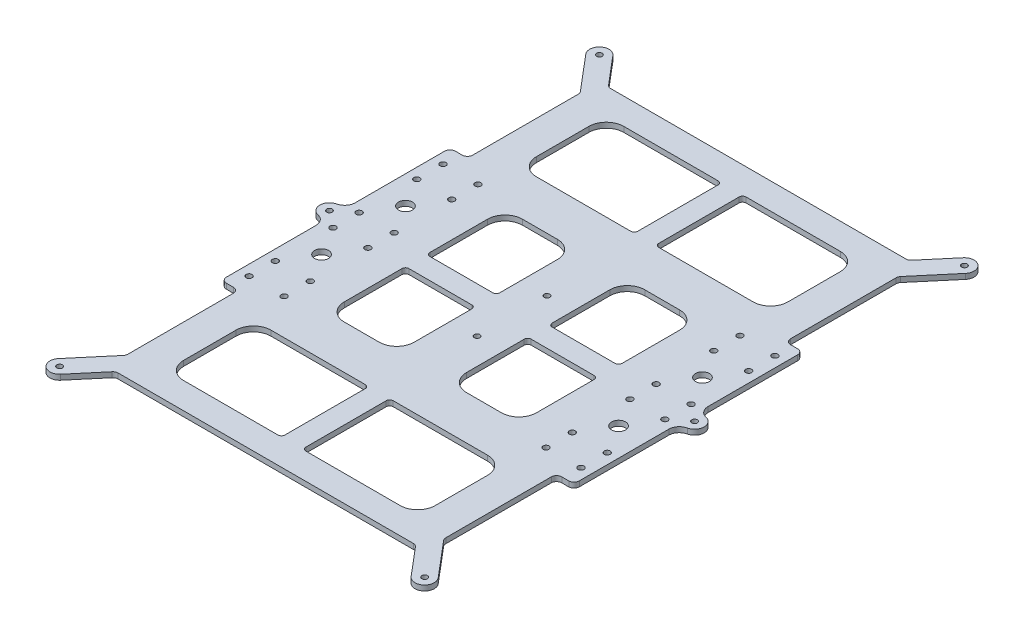
from build123d import *

# Parameters (mm, degrees)
CROQUIS1_W              = 220
CROQUIS1_H              = 320
CROQUIS1_R              = 1.7
CROQUIS1_R_2            = 1.6
CROQUIS1_R_3            = 4
SALIENTE_EXTRUIR1_DEPTH = 3
CROQUIS2_OUTSIDE_W      = 299.668
CROQUIS2_OUTSIDE_H      = 399.668
CORTAR_EXTRUIR1_DEPTH   = 3
REDONDEO1_R             = 3


with BuildPart() as part:
    # Croquis1 → Saliente-Extruir1 (new body)
    with BuildSketch(Plane(origin=(0, 0, 0), x_dir=(1, 0, 0), z_dir=(0, 1, 0))):
        with Locations((110, 160)):
            Rectangle(CROQUIS1_W, CROQUIS1_H)
        with Locations(Location((185, 167.5, 0), (0, 0, 270))):
            Circle(CROQUIS1_R, mode=Mode.SUBTRACT)
        with Locations(Location((205, 167.5, 0), (0, 0, 270))):
            Circle(CROQUIS1_R, mode=Mode.SUBTRACT)
        with Locations(Location((185, 152.5, 0), (0, 0, 90))):
            Circle(CROQUIS1_R, mode=Mode.SUBTRACT)
        with Locations(Location((205, 152.5, 0), (0, 0, 90))):
            Circle(CROQUIS1_R, mode=Mode.SUBTRACT)
        with Locations(Location((35, 215.5, 0), (0, 0, 270))):
            Circle(CROQUIS1_R, mode=Mode.SUBTRACT)
        with Locations(Location((35, 200.5, 0), (0, 0, 270))):
            Circle(CROQUIS1_R, mode=Mode.SUBTRACT)
        with Locations(Location((35, 119.5, 0), (0, 0, 90))):
            Circle(CROQUIS1_R, mode=Mode.SUBTRACT)
        with Locations(Location((35, 104.5, 0), (0, 0, 90))):
            Circle(CROQUIS1_R, mode=Mode.SUBTRACT)
        with Locations(Location((5.5, 314.5, 0), (0, 0, 270))):
            Circle(CROQUIS1_R_2, mode=Mode.SUBTRACT)
        with Locations(Location((214.5, 314.5, 0), (0, 0, 90))):
            Circle(CROQUIS1_R_2, mode=Mode.SUBTRACT)
        with Locations(Location((214.5, 5.5, 0), (0, 0, 270))):
            Circle(CROQUIS1_R_2, mode=Mode.SUBTRACT)
        with Locations(Location((5.5, 5.5, 0), (0, 0, 90))):
            Circle(CROQUIS1_R_2, mode=Mode.SUBTRACT)
        with Locations(Location((15, 200.5, 0), (0, 0, 90))):
            Circle(CROQUIS1_R, mode=Mode.SUBTRACT)
        with Locations(Location((15, 215.5, 0), (0, 0, 90))):
            Circle(CROQUIS1_R, mode=Mode.SUBTRACT)
        with Locations(Location((15, 104.5, 0), (0, 0, 270))):
            Circle(CROQUIS1_R, mode=Mode.SUBTRACT)
        with Locations(Location((15, 119.5, 0), (0, 0, 270))):
            Circle(CROQUIS1_R, mode=Mode.SUBTRACT)
        with Locations(Location((110, 180, 0), (0, 0, 270))):
            Circle(CROQUIS1_R_2, mode=Mode.SUBTRACT)
        with Locations(Location((110, 140, 0), (0, 0, 90))):
            Circle(CROQUIS1_R_2, mode=Mode.SUBTRACT)
        with Locations(Location((185, 104.5, 0), (0, 0, 270))):
            Circle(CROQUIS1_R, mode=Mode.SUBTRACT)
        with Locations(Location((205, 104.5, 0), (0, 0, 90))):
            Circle(CROQUIS1_R, mode=Mode.SUBTRACT)
        with Locations(Location((205, 119.5, 0), (0, 0, 90))):
            Circle(CROQUIS1_R, mode=Mode.SUBTRACT)
        with Locations(Location((185, 119.5, 0), (0, 0, 270))):
            Circle(CROQUIS1_R, mode=Mode.SUBTRACT)
        with Locations(Location((185, 200.5, 0), (0, 0, 90))):
            Circle(CROQUIS1_R, mode=Mode.SUBTRACT)
        with Locations(Location((185, 215.5, 0), (0, 0, 90))):
            Circle(CROQUIS1_R, mode=Mode.SUBTRACT)
        with Locations(Location((205, 200.5, 0), (0, 0, 270))):
            Circle(CROQUIS1_R, mode=Mode.SUBTRACT)
        with Locations(Location((205, 215.5, 0), (0, 0, 270))):
            Circle(CROQUIS1_R, mode=Mode.SUBTRACT)
        with Locations(Location((5.5, 160, 0), (0, 0, 270))):
            Circle(CROQUIS1_R_2, mode=Mode.SUBTRACT)
        with Locations(Location((35, 152.5, 0), (0, 0, 270))):
            Circle(CROQUIS1_R, mode=Mode.SUBTRACT)
        with Locations(Location((15, 152.5, 0), (0, 0, 270))):
            Circle(CROQUIS1_R, mode=Mode.SUBTRACT)
        with Locations(Location((15, 167.5, 0), (0, 0, 90))):
            Circle(CROQUIS1_R, mode=Mode.SUBTRACT)
        with Locations(Location((35, 167.5, 0), (0, 0, 90))):
            Circle(CROQUIS1_R, mode=Mode.SUBTRACT)
        with Locations(Location((214.5, 160, 0), (0, 0, 90))):
            Circle(CROQUIS1_R_2, mode=Mode.SUBTRACT)
        with Locations(Location((25, 136, 0), (0, 0, 270))):
            Circle(CROQUIS1_R_3, mode=Mode.SUBTRACT)
        with Locations(Location((25, 184, 0), (0, 0, 90))):
            Circle(CROQUIS1_R_3, mode=Mode.SUBTRACT)
        with Locations(Location((195, 136, 0), (0, 0, 90))):
            Circle(CROQUIS1_R_3, mode=Mode.SUBTRACT)
        with Locations(Location((195, 184, 0), (0, 0, 270))):
            Circle(CROQUIS1_R_3, mode=Mode.SUBTRACT)
    extrude(amount=SALIENTE_EXTRUIR1_DEPTH)

    # Croquis2 outside → Cortar-Extruir1 (cut)
    # profile 1 of 9: a face of its own
    with BuildSketch(Plane(origin=(0, 3, 0), x_dir=(1, 0, 0), z_dir=(0, 1, 0))):
        with Locations((110, 160)):
            Rectangle(CROQUIS2_OUTSIDE_W, CROQUIS2_OUTSIDE_H)
        with BuildLine():
            Line((9, 148.77502784), (9, 94.5))
            Line((9, 94.5), (19, 94.5))
            Line((19, 94.5), (19, 30))
            Line((19, 30), (1.298802547, 9.049639413))
            ThreePointArc((1.298802547, 9.049639413), (1.950360587, 1.298802547), (9.701197453, 1.950360587))
            Line((9.701197453, 1.950360587), (24.106631311, 19))
            Line((24.106631311, 19), (195.893368689, 19))
            Line((195.893368689, 19), (210.298802547, 1.950360587))
            ThreePointArc((210.298802547, 1.950360587), (218.049639413, 1.298802547), (218.701197453, 9.049639413))
            Line((218.701197453, 9.049639413), (201, 30))
            Line((201, 30), (201, 94.5))
            Line((201, 94.5), (211, 94.5))
            Line((211, 94.5), (211, 148.77502784))
            ThreePointArc((211, 148.77502784), (212.318863014, 152.528287293), (215.695652174, 154.631535054))
            ThreePointArc((215.695652174, 154.631535054), (220, 160), (215.695652174, 165.368464946))
            ThreePointArc((215.695652174, 165.368464946), (212.318863014, 167.471712707), (211, 171.22497216))
            Line((211, 171.22497216), (211, 225.5))
            Line((211, 225.5), (201, 225.5))
            Line((201, 225.5), (201, 290))
            Line((201, 290), (218.701197453, 310.950360587))
            ThreePointArc((218.701197453, 310.950360587), (218.049639413, 318.701197453), (210.298802547, 318.049639413))
            Line((210.298802547, 318.049639413), (195.893368689, 301))
            Line((195.893368689, 301), (24.106631311, 301))
            Line((24.106631311, 301), (9.701197453, 318.049639413))
            ThreePointArc((9.701197453, 318.049639413), (1.950360587, 318.701197453), (1.298802547, 310.950360587))
            Line((1.298802547, 310.950360587), (19, 290))
            Line((19, 290), (19, 225.5))
            Line((19, 225.5), (9, 225.5))
            Line((9, 225.5), (9, 171.22497216))
            ThreePointArc((9, 171.22497216), (7.681136986, 167.471712707), (4.304347826, 165.368464946))
            ThreePointArc((4.304347826, 165.368464946), (0, 160), (4.304347826, 154.631535054))
            ThreePointArc((4.304347826, 154.631535054), (7.681136986, 152.528287293), (9, 148.77502784))
        make_face(mode=Mode.SUBTRACT)
    # profile 2 of 9: a face of its own
    with BuildSketch(Plane(origin=(0, 3, 0), x_dir=(1, 0, 0), z_dir=(0, 1, 0))):
        with BuildLine():
            Line((182, 276), (182, 246))
            ThreePointArc((182, 246), (179.071067812, 238.928932188), (172, 236))
            Line((172, 236), (118, 236))
            ThreePointArc((118, 236), (116.585786438, 236.585786438), (116, 238))
            Line((116, 238), (116, 284))
            ThreePointArc((116, 284), (116.585786438, 285.414213562), (118, 286))
            Line((118, 286), (172, 286))
            ThreePointArc((172, 286), (179.071067812, 283.071067812), (182, 276))
        make_face()
    # profile 3 of 9: a face of its own
    with BuildSketch(Plane(origin=(0, 3, 0), x_dir=(1, 0, 0), z_dir=(0, 1, 0))):
        with BuildLine():
            Line((102, 286), (48, 286))
            ThreePointArc((48, 286), (40.928932188, 283.071067812), (38, 276))
            Line((38, 276), (38, 246))
            ThreePointArc((38, 246), (40.928932188, 238.928932188), (48, 236))
            Line((48, 236), (102, 236))
            ThreePointArc((102, 236), (103.414213562, 236.585786438), (104, 238))
            Line((104, 238), (104, 284))
            ThreePointArc((104, 284), (103.414213562, 285.414213562), (102, 286))
        make_face()
    # profile 4 of 9: a face of its own
    with BuildSketch(Plane(origin=(0, 3, 0), x_dir=(1, 0, 0), z_dir=(0, 1, 0))):
        with BuildLine():
            Line((102, 84), (48, 84))
            ThreePointArc((48, 84), (40.928932188, 81.071067812), (38, 74))
            Line((38, 74), (38, 44))
            ThreePointArc((38, 44), (40.928932188, 36.928932188), (48, 34))
            Line((48, 34), (102, 34))
            ThreePointArc((102, 34), (103.414213562, 34.585786438), (104, 36))
            Line((104, 36), (104, 82))
            ThreePointArc((104, 82), (103.414213562, 83.414213562), (102, 84))
        make_face()
    # profile 5 of 9: a face of its own
    with BuildSketch(Plane(origin=(0, 3, 0), x_dir=(1, 0, 0), z_dir=(0, 1, 0))):
        with BuildLine():
            Line((116, 36), (116, 82))
            ThreePointArc((116, 82), (116.585786438, 83.414213562), (118, 84))
            Line((118, 84), (172, 84))
            ThreePointArc((172, 84), (179.071067812, 81.071067812), (182, 74))
            Line((182, 74), (182, 44))
            ThreePointArc((182, 44), (179.071067812, 36.928932188), (172, 34))
            Line((172, 34), (118, 34))
            ThreePointArc((118, 34), (116.585786438, 34.585786438), (116, 36))
        make_face()
    # profile 6 of 9: a face of its own
    with BuildSketch(Plane(origin=(0, 3, 0), x_dir=(1, 0, 0), z_dir=(0, 1, 0))):
        with BuildLine():
            Line((55, 152), (55, 119))
            ThreePointArc((55, 119), (57.928932188, 111.928932188), (65, 109))
            Line((65, 109), (85, 109))
            ThreePointArc((85, 109), (92.071067812, 111.928932188), (95, 119))
            Line((95, 119), (95, 152))
            ThreePointArc((95, 152), (94.414213562, 153.414213562), (93, 154))
            Line((93, 154), (57, 154))
            ThreePointArc((57, 154), (55.585786438, 153.414213562), (55, 152))
        make_face()
    # profile 7 of 9: a face of its own
    with BuildSketch(Plane(origin=(0, 3, 0), x_dir=(1, 0, 0), z_dir=(0, 1, 0))):
        with BuildLine():
            Line((93, 166), (57, 166))
            ThreePointArc((57, 166), (55.585786438, 166.585786438), (55, 168))
            Line((55, 168), (55, 201))
            ThreePointArc((55, 201), (57.928932188, 208.071067812), (65, 211))
            Line((65, 211), (85, 211))
            ThreePointArc((85, 211), (92.071067812, 208.071067812), (95, 201))
            Line((95, 201), (95, 168))
            ThreePointArc((95, 168), (94.414213562, 166.585786438), (93, 166))
        make_face()
    # profile 8 of 9: a face of its own
    with BuildSketch(Plane(origin=(0, 3, 0), x_dir=(1, 0, 0), z_dir=(0, 1, 0))):
        with BuildLine():
            Line((135, 109), (155, 109))
            ThreePointArc((155, 109), (162.071067812, 111.928932188), (165, 119))
            Line((165, 119), (165, 152))
            ThreePointArc((165, 152), (164.414213562, 153.414213562), (163, 154))
            Line((163, 154), (127, 154))
            ThreePointArc((127, 154), (125.585786438, 153.414213562), (125, 152))
            Line((125, 152), (125, 119))
            ThreePointArc((125, 119), (127.928932188, 111.928932188), (135, 109))
        make_face()
    # profile 9 of 9: a face of its own
    with BuildSketch(Plane(origin=(0, 3, 0), x_dir=(1, 0, 0), z_dir=(0, 1, 0))):
        with BuildLine():
            Line((127, 166), (163, 166))
            ThreePointArc((163, 166), (164.414213562, 166.585786438), (165, 168))
            Line((165, 168), (165, 201))
            ThreePointArc((165, 201), (162.071067812, 208.071067812), (155, 211))
            Line((155, 211), (135, 211))
            ThreePointArc((135, 211), (127.928932188, 208.071067812), (125, 201))
            Line((125, 201), (125, 168))
            ThreePointArc((125, 168), (125.585786438, 166.585786438), (127, 166))
        make_face()
    extrude(amount=-CORTAR_EXTRUIR1_DEPTH, mode=Mode.SUBTRACT)

    # Redondeo1
    redondeo1_edges = [part.edges().sort_by_distance(p)[0] for p in [
        (19, 1.5, -94.5),
        (9, 1.5, -94.5),
        (9, 1.5, -225.5),
        (19, 1.5, -225.5),
        (19, 1.5, -290),
        (24.106631311, 1.5, -301),
        (195.893368689, 1.5, -301),
        (201, 1.5, -290),
        (201, 1.5, -225.5),
        (211, 1.5, -225.5),
        (211, 1.5, -94.5),
        (201, 1.5, -94.5),
        (201, 1.5, -30),
        (195.893368689, 1.5, -19),
        (24.106631311, 1.5, -19),
        (19, 1.5, -30),
    ]]
    fillet(redondeo1_edges, radius=REDONDEO1_R)


solid = part.part
